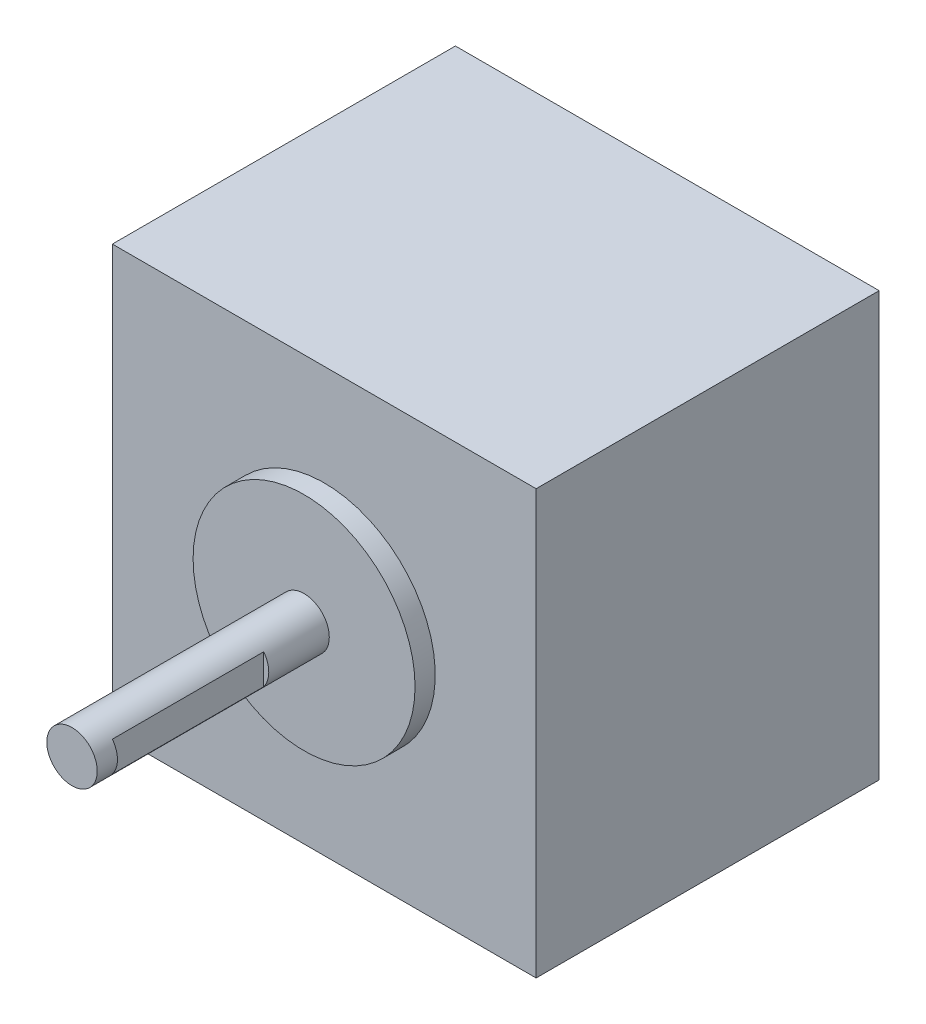
from build123d import *

# Parameters (mm, degrees)
SKETCH1_W           = 42
SKETCH1_H           = 42
BOSS_EXTRUDE1_DEPTH = 34
SKETCH2_R           = 2.5
BOSS_EXTRUDE2_DEPTH = 25
SKETCH3_R           = 11
BOSS_EXTRUDE3_DEPTH = 2
SKETCH4_W           = 1
SKETCH4_H           = 6
CUT_EXTRUDE1_DEPTH  = 15


with BuildPart() as part:
    # Sketch1 → Boss-Extrude1 (new body)
    with BuildSketch(Plane.XY):
        Rectangle(SKETCH1_W, SKETCH1_H)
    extrude(amount=-BOSS_EXTRUDE1_DEPTH)

    # Sketch2 → Boss-Extrude2 (add)
    with BuildSketch(Plane.XY):
        Circle(SKETCH2_R)
    extrude(amount=BOSS_EXTRUDE2_DEPTH)

    # Sketch3 → Boss-Extrude3 (add)
    with BuildSketch(Plane.XY):
        with Locations(Location((0, 0, 0), (0, 0, 180))):
            Circle(SKETCH3_R)
    extrude(amount=BOSS_EXTRUDE3_DEPTH)

    # Sketch4 → Cut-Extrude1 (cut)
    with BuildSketch(Plane.XY.offset(23)):
        with Locations((2.5, 0)):
            Rectangle(SKETCH4_W, SKETCH4_H)
    extrude(amount=-CUT_EXTRUDE1_DEPTH, mode=Mode.SUBTRACT)


solid = part.part
